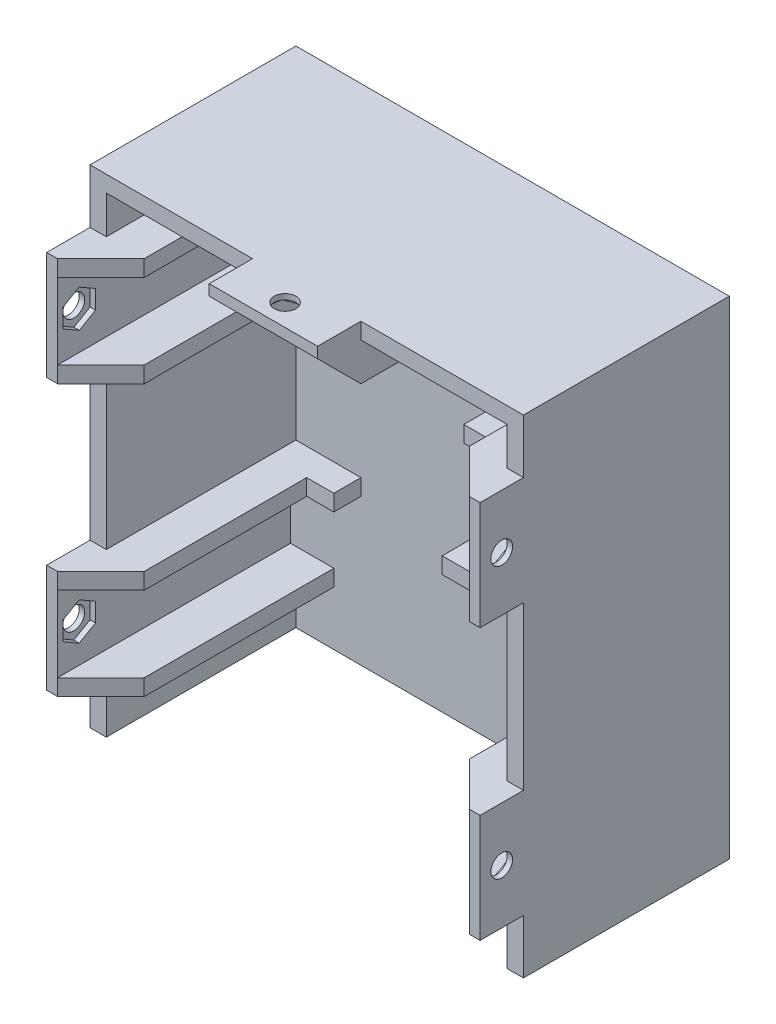
from build123d import *

# Parameters (mm, degrees)
SKETCH1_W               = 80
SKETCH1_H               = 90
BOSS_EXTRUDE1_DEPTH     = 3
BOSS_EXTRUDE2_DEPTH     = 8
CUT_EXTRUDE1_DEPTH      = 114.670576668
SKETCH6_R               = 2
CUT_EXTRUDE3_DEPTH      = 25
MIRROR5_COPY_1_DEPTH    = 8
MIRROR5_COPY_2_DEPTH    = 114.670576668
MIRROR5_COPY_3_SKETCH_R = 2
MIRROR5_COPY_3_DEPTH    = 25
BOSS_EXTRUDE3_DEPTH     = 8
CUT_EXTRUDE2_DEPTH      = 25
SKETCH7_R               = 2
CUT_EXTRUDE4_DEPTH      = 25
SKETCH9_W               = 80
SKETCH9_H               = 90
BOSS_EXTRUDE7_DEPTH     = 35
CUT_EXTRUDE5_DEPTH      = 35
SKETCH11_W              = 13
SKETCH11_H              = 3
SKETCH11_W_2            = 10
SKETCH11_W_3            = 7
BOSS_EXTRUDE8_DEPTH     = 5
SKETCH12_W              = 9
SKETCH12_H              = 11
CUT_EXTRUDE6_DEPTH      = 46
SKETCH13_W              = 5
SKETCH13_H              = 12
CUT_EXTRUDE7_DEPTH      = 128.863208156
CUT_EXTRUDE8_DEPTH      = 1
CUT_EXTRUDE9_DEPTH      = 1
MIRROR7_COPY_1_DEPTH    = 1


with BuildPart() as part:
    # Sketch1 → Boss-Extrude1 (new body)
    with BuildSketch(Plane.XY):
        with Locations((40, 45)):
            Rectangle(SKETCH1_W, SKETCH1_H)
    extrude(amount=BOSS_EXTRUDE1_DEPTH)

    # Sketch2 → Boss-Extrude2 (add)
    with BuildSketch(Plane.XY.offset(3)):
        Polygon((0, 80), (10, 80), (10, 77), (2, 77), (2, 63), (10, 63), (10, 60), (0, 60), align=None)
    boss_extrude2 = extrude(amount=BOSS_EXTRUDE2_DEPTH)

    # Sketch3 → Cut-Extrude1 (cut, through all)
    with BuildSketch(Plane(origin=(0, 80, 0), x_dir=(1, 0, 0), z_dir=(0, 1, 0))):
        Polygon((10, -3), (2, -11), (10, -11), align=None)
    cut_extrude1 = extrude(amount=-CUT_EXTRUDE1_DEPTH, mode=Mode.SUBTRACT)

    # Sketch6 → Cut-Extrude3 (cut)
    with BuildSketch(Plane(origin=(2, 0, 0), x_dir=(0, 0, -1), z_dir=(1, 0, 0))):
        with Locations(Location((-7, 70, 0), (0, 0, 90))):
            Circle(SKETCH6_R)
    cut_extrude3 = extrude(amount=-CUT_EXTRUDE3_DEPTH, mode=Mode.SUBTRACT)

    # Mirror4: Boss-Extrude2, Cut-Extrude1, Cut-Extrude3 across plane
    add(boss_extrude2.mirror(Plane(origin=(40, 0, 0), x_dir=(0, 0, 1), z_dir=(1, 0, 0))))
    add(cut_extrude1.mirror(Plane(origin=(40, 0, 0), x_dir=(0, 0, 1), z_dir=(1, 0, 0))), mode=Mode.SUBTRACT)
    add(cut_extrude3.mirror(Plane(origin=(40, 0, 0), x_dir=(0, 0, 1), z_dir=(1, 0, 0))), mode=Mode.SUBTRACT)

    # Mirror5: Boss-Extrude2, Cut-Extrude1, Cut-Extrude3 across plane
    add(boss_extrude2.mirror(Plane(origin=(0, 45, 0), x_dir=(0, 0, 1), z_dir=(0, -1, 0))))
    add(cut_extrude1.mirror(Plane(origin=(0, 45, 0), x_dir=(0, 0, 1), z_dir=(0, -1, 0))), mode=Mode.SUBTRACT)
    add(cut_extrude3.mirror(Plane(origin=(0, 45, 0), x_dir=(0, 0, 1), z_dir=(0, -1, 0))), mode=Mode.SUBTRACT)

    # Mirror5 copy 1 sketch → Mirror5 copy 1 (add)
    with BuildSketch(Plane(origin=(80, 90, 3), x_dir=(-1, 0, 0), z_dir=(0, 0, 1))):
        Polygon((0, 80), (10, 80), (10, 77), (2, 77), (2, 63), (10, 63), (10, 60), (0, 60), align=None)
    extrude(amount=MIRROR5_COPY_1_DEPTH)

    # Mirror5 copy 2 sketch → Mirror5 copy 2 (cut, through all)
    with BuildSketch(Plane(origin=(80, 10, 0), x_dir=(-1, 0, 0), z_dir=(0, -1, 0))):
        Polygon((10, -3), (2, -11), (10, -11), align=None)
    extrude(amount=-MIRROR5_COPY_2_DEPTH, mode=Mode.SUBTRACT)

    # Mirror5 copy 3 sketch → Mirror5 copy 3 (cut)
    with BuildSketch(Plane(origin=(78, 90, 0), x_dir=(0, 0, -1), z_dir=(-1, 0, 0))):
        with Locations(Location((-7, 70, 0), (0, 0, 90))):
            Circle(MIRROR5_COPY_3_SKETCH_R)
    extrude(amount=-MIRROR5_COPY_3_DEPTH, mode=Mode.SUBTRACT)

    # Sketch4 → Boss-Extrude3 (add)
    with BuildSketch(Plane.XY.offset(3)):
        Polygon((30, 90), (50, 90), (50, 80), (47, 80), (47, 88), (33, 88), (33, 80), (30, 80), align=None)
    extrude(amount=BOSS_EXTRUDE3_DEPTH)

    # Sketch5 → Cut-Extrude2 (cut)
    with BuildSketch(Plane.ZY.offset(-30)):
        Polygon((3, 80), (11, 88), (11, 80), align=None)
    extrude(amount=-CUT_EXTRUDE2_DEPTH, mode=Mode.SUBTRACT)

    # Sketch7 → Cut-Extrude4 (cut)
    with BuildSketch(Plane.XZ.offset(-88)):
        with Locations(Location((40, 7, 0), (0, 0, 270))):
            Circle(SKETCH7_R)
    extrude(amount=-CUT_EXTRUDE4_DEPTH, mode=Mode.SUBTRACT)

    # Sketch9 → Boss-Extrude7 (add)
    with BuildSketch(Plane(origin=(0, 0, 0), x_dir=(-1, 0, 0), z_dir=(0, 0, -1))):
        with Locations((-40, 45)):
            Rectangle(SKETCH9_W, SKETCH9_H)
    extrude(amount=BOSS_EXTRUDE7_DEPTH)

    # Sketch10 → Cut-Extrude5 (cut)
    with BuildSketch(Plane.XY.offset(3)):
        Polygon((30, 87), (3, 87), (3, 80), (10, 80), (10, 77), (2, 77), (2, 63), (10, 63), (10, 60), (3, 60), (3, 30), (10, 30), (10, 27), (2, 27), (2, 13), (10, 13), (10, 10), (3, 10), (3, 0), (77, 0), (77, 10), (70, 10), (70, 13), (78, 13), (78, 27), (70, 27), (70, 30), (77, 30), (77, 60), (70, 60), (70, 63), (78, 63), (78, 77), (70, 77), (70, 80), (77, 80), (77, 87), (50, 87), (50, 80), (47, 80), (47, 88), (33, 88), (33, 80), (30, 80), align=None)
    extrude(amount=-CUT_EXTRUDE5_DEPTH, mode=Mode.SUBTRACT)

    # Sketch11 → Boss-Extrude8 (add)
    with BuildSketch(Plane.XY.offset(-32)):
        with Locations((8.5, 28.5)):
            Rectangle(SKETCH11_W, SKETCH11_H)
        with Locations((9.5, 51.5)):
            Rectangle(SKETCH11_W, SKETCH11_H)
        with Locations((40, 28.5)):
            Rectangle(SKETCH11_W_2, SKETCH11_H)
        with Locations((42.5, 51.5)):
            Rectangle(SKETCH11_W_3, SKETCH11_H)
    extrude(amount=BOSS_EXTRUDE8_DEPTH)

    # Sketch12 → Cut-Extrude6 (cut)
    with BuildSketch(Plane.XY.offset(-32)):
        with Locations((60.5, 63.5)):
            Rectangle(SKETCH12_W, SKETCH12_H)
    extrude(amount=-CUT_EXTRUDE6_DEPTH, mode=Mode.SUBTRACT)

    # Sketch13 → Cut-Extrude7 (cut, through all)
    with BuildSketch(Plane.XY.offset(-32)):
        with Locations((47.414473157, 64)):
            Rectangle(SKETCH13_W, SKETCH13_H)
    extrude(amount=-CUT_EXTRUDE7_DEPTH, mode=Mode.SUBTRACT)

    # Sketch14 → Cut-Extrude8 (cut)
    with BuildSketch(Plane.XZ.offset(-88)):
        Polygon((43.207910709, 5.692594599), (42.736201645, 9.124429466), (39.528290936, 10.431834868), (36.792089291, 8.307405401), (37.263798355, 4.875570534), (40.471709064, 3.568165132), align=None)
    extrude(amount=-CUT_EXTRUDE8_DEPTH, mode=Mode.SUBTRACT)

    # Sketch15 → Cut-Extrude9 (cut)
    with BuildSketch(Plane.ZY.offset(-78)):
        Polygon((9.993076519, 68.256012342), (10.006875875, 71.720086472), (7.013799356, 73.46407413), (4.006923481, 71.743987658), (3.993124125, 68.279913528), (6.986200644, 66.53592587), align=None)
    cut_extrude9 = extrude(amount=-CUT_EXTRUDE9_DEPTH, mode=Mode.SUBTRACT)

    # Mirror6: Cut-Extrude9 across plane
    add(cut_extrude9.mirror(Plane(origin=(40, 0, 0), x_dir=(0, 0, 1), z_dir=(1, 0, 0))), mode=Mode.SUBTRACT)

    # Mirror7: Cut-Extrude9 across plane
    add(cut_extrude9.mirror(Plane(origin=(0, 45, 0), x_dir=(0, 0, 1), z_dir=(0, -1, 0))), mode=Mode.SUBTRACT)

    # Mirror7 copy 1 sketch → Mirror7 copy 1 (cut)
    with BuildSketch(Plane(origin=(2, 90, 0), x_dir=(0, 0, 1), z_dir=(1, 0, 0))):
        Polygon((9.993076519, 68.256012342), (10.006875875, 71.720086472), (7.013799356, 73.46407413), (4.006923481, 71.743987658), (3.993124125, 68.279913528), (6.986200644, 66.53592587), align=None)
    extrude(amount=-MIRROR7_COPY_1_DEPTH, mode=Mode.SUBTRACT)


solid = part.part
